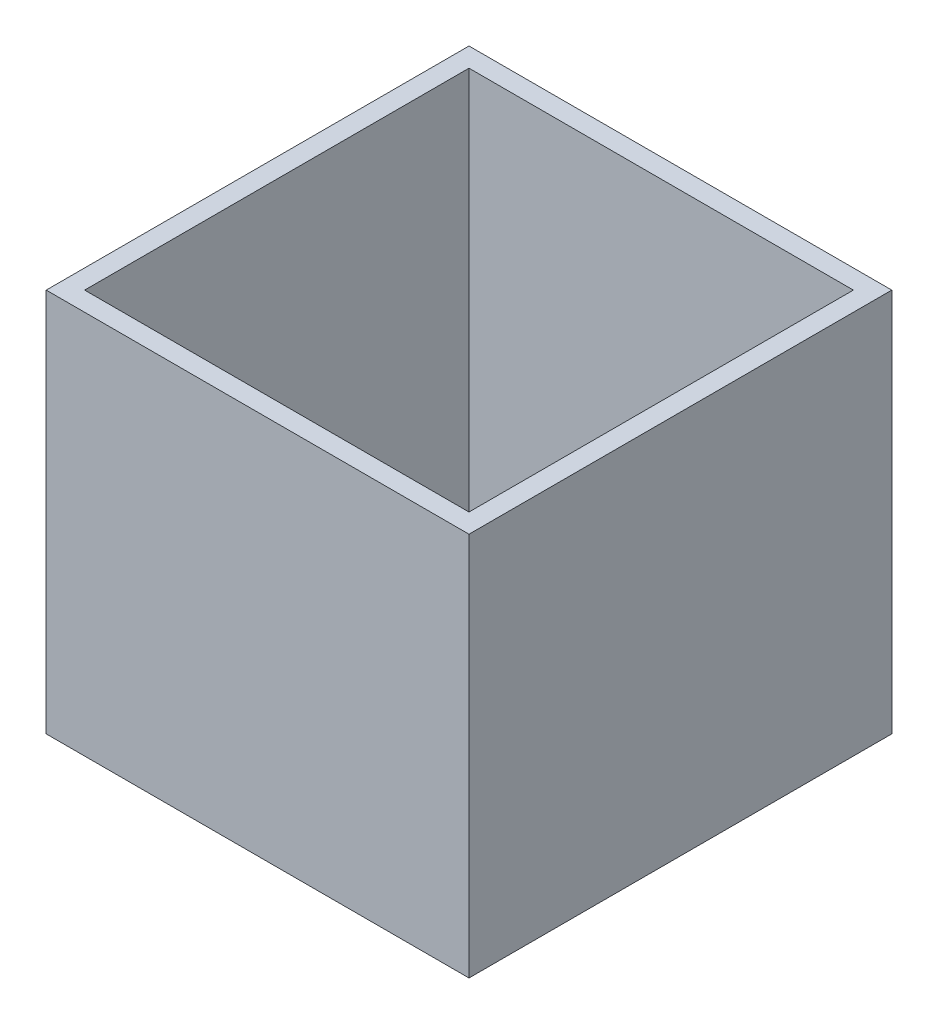
from build123d import *

# Parameters (mm, degrees)
SKETCH2_W           = 76.2
SKETCH2_H           = 76.2
BOSS_EXTRUDE2_DEPTH = 76.2
SHELL1_T            = 3.81


with BuildPart() as part:
    # Sketch2 → Boss-Extrude2 (new body)
    with BuildSketch(Plane(origin=(0, 0, 0), x_dir=(1, 0, 0), z_dir=(0, 1, 0))):
        Rectangle(SKETCH2_W, SKETCH2_H)
    extrude(amount=BOSS_EXTRUDE2_DEPTH)

    # Shell1
    shell1_openings = [part.faces().sort_by_distance(p)[0] for p in [
        (0, 0, 0),
        (0, 76.2, 0),
    ]]
    offset(amount=SHELL1_T, openings=shell1_openings, kind=Kind.INTERSECTION)


solid = part.part
